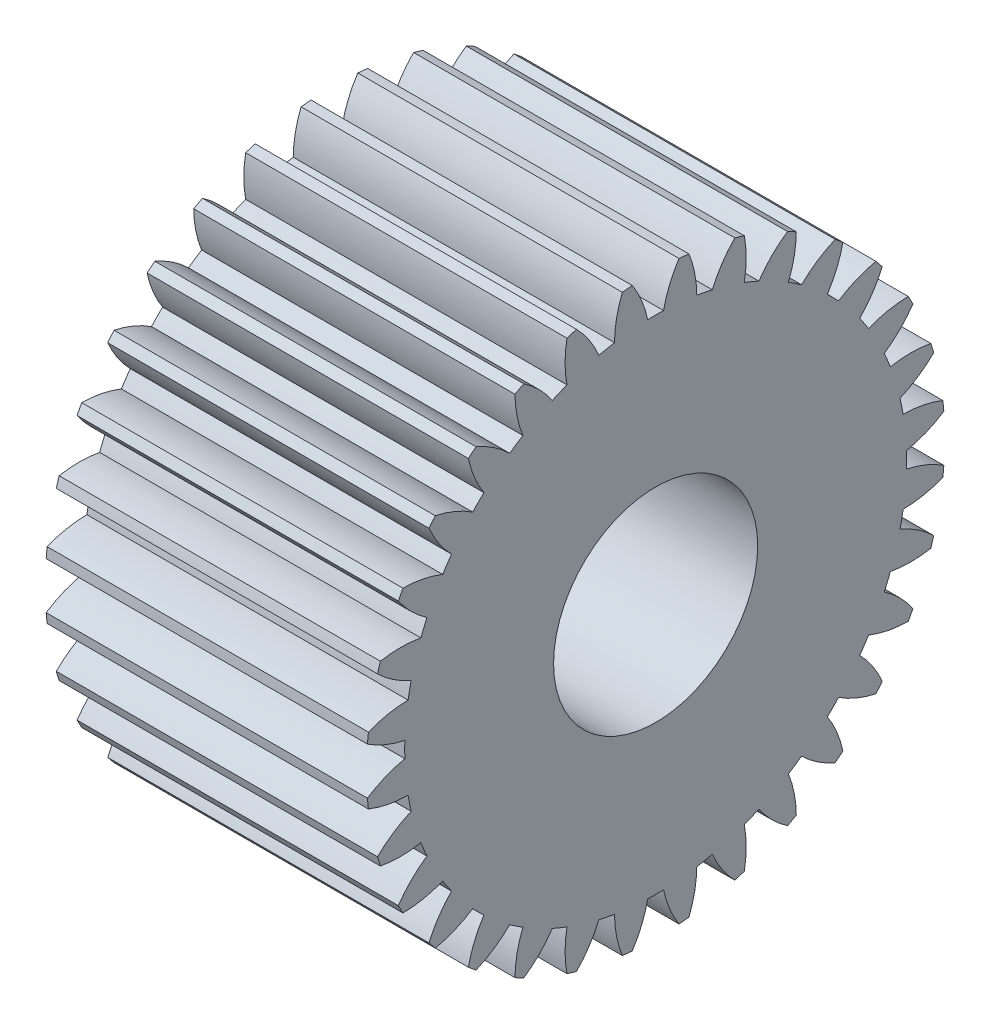
from build123d import *

# Parameters (mm, degrees)
BASPROSKE_W     = 19.9898
BASPROSKE_H     = 17.991666667
TOOTHCUT_DEPTH  = 33.357259509
TEETHCUTS_COUNT = 32
TEETHCUTS_ANGLE = 348.75
BORSKE_R        = 6.35
BORE_DEPTH      = 50.8000508


with BuildPart() as part:
    # BasProSke → Base-Revolve (revolve)
    with BuildSketch(Plane(origin=(0, 0, 0), x_dir=(1, 0, 0), z_dir=(0, 1, 0)), mode=Mode.PRIVATE) as base_revolve_sk:
        with Locations((9.9949, 8.995833334)):
            Rectangle(BASPROSKE_W, BASPROSKE_H)
    revolve(base_revolve_sk.sketch.rotate(Axis((-10, 0, 0), (1, 0, 0)), 180), axis=Axis((-10, 0, 0), (1, 0, 0)))

    # TooCutSke → ToothCut (cut, through all)
    with BuildSketch(Plane(origin=(0, 0, 0), x_dir=(0, 0, -1), z_dir=(1, 0, 0))):
        with BuildLine():
            ThreePointArc((0.493606516, 15.60472844), (0, 15.612533333), (-0.493606516, 15.60472844))
            ThreePointArc((-0.493606516, 15.60472844), (-0.870857923, 16.827183574), (-1.471244405, 17.956896479))
            ThreePointArc((-1.471244405, 17.956896479), (0, 18.017066667), (1.471244405, 17.956896479))
            ThreePointArc((1.471244405, 17.956896479), (0.870857923, 16.827183574), (0.493606516, 15.60472844))
        make_face()
    toothcut = extrude(amount=TOOTHCUT_DEPTH, mode=Mode.SUBTRACT)

    # TeethCuts: ToothCut ×32 about axis
    teethcuts_axis = Axis((-10, 0, 0), (1, 0, 0))
    for i in range(1, TEETHCUTS_COUNT):
        add(toothcut.rotate(teethcuts_axis, i * TEETHCUTS_ANGLE / (TEETHCUTS_COUNT - 1)), mode=Mode.SUBTRACT)

    # BorSke → Bore (cut, symmetric)
    with BuildSketch(Plane(origin=(0, 0, 0), x_dir=(0, 0, -1), z_dir=(1, 0, 0))):
        with Locations(Location((0, 0, 0), (0, 0, 180))):
            Circle(BORSKE_R)
    extrude(amount=BORE_DEPTH, both=True, mode=Mode.SUBTRACT)


solid = part.part
